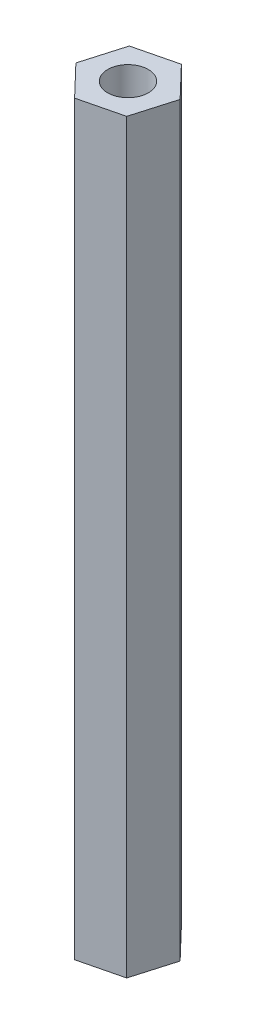
from build123d import *

# Parameters (mm, degrees)
BOSS_EXTRUDE1_DEPTH = 63.5
SKETCH2_R           = 1.7272
CUT_EXTRUDE1_DEPTH  = 9.525
CUT_EXTRUDE2_START  = -9.525
SKETCH3_R           = 1.7272
CUT_EXTRUDE2_DEPTH  = 9.525


with BuildPart() as part:
    # Sketch1 → Boss-Extrude1 (new body)
    with BuildSketch(Plane(origin=(0, 0, 0), x_dir=(1, 0, 0), z_dir=(0, 1, 0))):
        Polygon((-2.767735883, 3.334911674), (-1.744793251, 6.855482892), (-4.282226046, 9.501662807), (-7.842601473, 8.627271504), (-8.865544105, 5.106700285), (-6.32811131, 2.46052037), align=None)
    extrude(amount=BOSS_EXTRUDE1_DEPTH)

    # Sketch2 → Cut-Extrude1 (cut)
    with BuildSketch(Plane(origin=(0, 63.5, 0), x_dir=(1, 0, 0), z_dir=(0, 1, 0))):
        with Locations(Location((-5.305168678, 5.981091589, 0), (0, 0, 270))):
            Circle(SKETCH2_R)
    extrude(amount=-CUT_EXTRUDE1_DEPTH, mode=Mode.SUBTRACT)

    # Sketch3 → Cut-Extrude2 (cut)
    with BuildSketch(Plane.XZ.offset(CUT_EXTRUDE2_START)):
        with Locations(Location((-5.305168678, -5.981091589, 0), (0, 0, 90))):
            Circle(SKETCH3_R)
    extrude(amount=CUT_EXTRUDE2_DEPTH, mode=Mode.SUBTRACT)


solid = part.part
